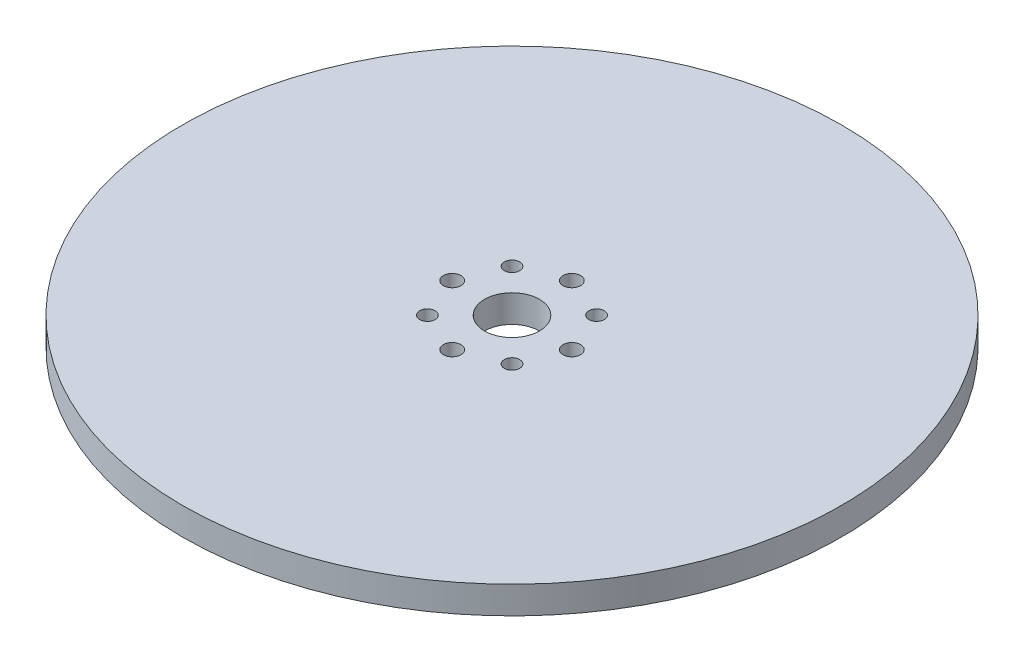
from build123d import *

# Parameters (mm, degrees)
SKETCH1_R           = 76.2
SKETCH1_R_2         = 6.35
SKETCH1_R_3         = 2.032
SKETCH1_R_4         = 1.778
BOSS_EXTRUDE1_DEPTH = 6.35


with BuildPart() as part:
    # Sketch1 → Boss-Extrude1 (new body)
    with BuildSketch(Plane(origin=(0, 0, 0), x_dir=(1, 0, 0), z_dir=(0, 1, 0))):
        with Locations(Location((0, 0, 0), (0, 0, 270))):
            Circle(SKETCH1_R)
        with Locations(Location((0, 0, 0), (0, 0, 270))):
            Circle(SKETCH1_R_2, mode=Mode.SUBTRACT)
        with Locations(Location((0, 13.829594426, 0), (0, 0, 270))):
            Circle(SKETCH1_R_3, mode=Mode.SUBTRACT)
        with Locations(Location((13.829594426, 0, 0), (0, 0, 270))):
            Circle(SKETCH1_R_3, mode=Mode.SUBTRACT)
        with Locations(Location((0, -13.829594426, 0), (0, 0, 270))):
            Circle(SKETCH1_R_3, mode=Mode.SUBTRACT)
        with Locations(Location((-13.829594426, 0, 0), (0, 0, 270))):
            Circle(SKETCH1_R_3, mode=Mode.SUBTRACT)
        with Locations(Location((-9.779, 9.779, 0), (0, 0, 270))):
            Circle(SKETCH1_R_4, mode=Mode.SUBTRACT)
        with Locations(Location((9.779, 9.779, 0), (0, 0, 270))):
            Circle(SKETCH1_R_4, mode=Mode.SUBTRACT)
        with Locations(Location((9.779, -9.779, 0), (0, 0, 270))):
            Circle(SKETCH1_R_4, mode=Mode.SUBTRACT)
        with Locations(Location((-9.779, -9.779, 0), (0, 0, 270))):
            Circle(SKETCH1_R_4, mode=Mode.SUBTRACT)
    extrude(amount=BOSS_EXTRUDE1_DEPTH)


solid = part.part
